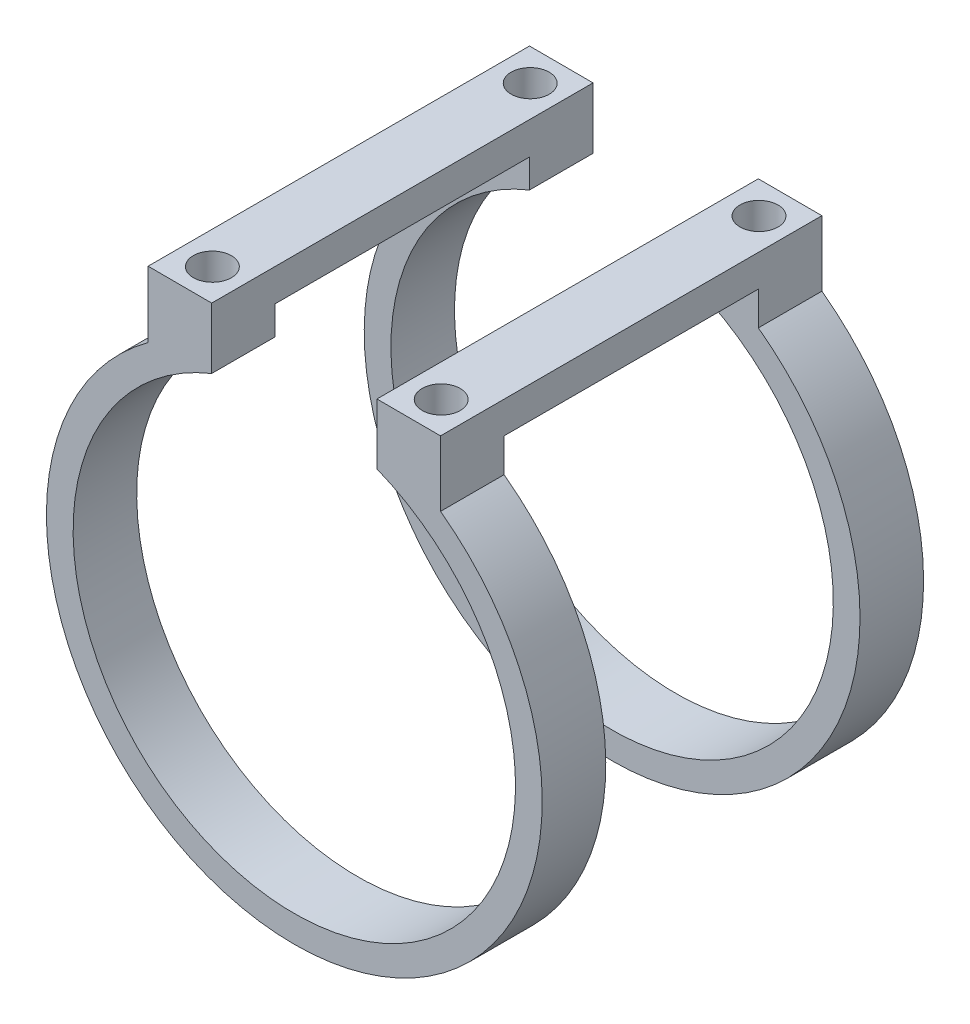
from build123d import *

# Parameters (mm, degrees)
SALIENTE_EXTRUIR1_DEPTH    = 30
CORTAR_EXTRUIR2_DEPTH      = 42.46352267
CORTAR_EXTRUIR2_DEPTH_BACK = 42.46352267
CROQUIS3_W                 = 20
CROQUIS3_H                 = 40.792863267
CORTAR_EXTRUIR3_DEPTH      = 55.00268459
CORTAR_EXTRUIR3_DEPTH_BACK = 10
CROQUIS4_R                 = 1.5


with BuildPart() as part:
    # Croquis1 → Saliente-Extruir1 (new body)
    with BuildSketch(Plane.XY):
        with BuildLine():
            Line((-6.5, 20.93890902), (-6.5, 16.140322178))
            ThreePointArc((-6.5, 16.140322178), (0, -17.4), (6.5, 16.140322178))
            Line((6.5, 16.140322178), (6.5, 20.905653754))
            Line((6.5, 20.905653754), (11.5, 20.892863267))
            Line((11.5, 20.892863267), (11.5, 15.748015748))
            ThreePointArc((11.5, 15.748015748), (0, -19.5), (-11.5, 15.748015748))
            Line((-11.5, 15.748015748), (-11.5, 20.951699507))
            Line((-11.5, 20.951699507), (-6.5, 20.93890902))
        make_face()
    extrude(amount=SALIENTE_EXTRUIR1_DEPTH)

    # Croquis3 → Cortar-Extruir2 (cut, two sides: drawn at the far end of the back side and taken through both)
    with BuildSketch(Plane(origin=(0, 0, 0), x_dir=(0, 0, -1), z_dir=(1, 0, 0)).offset(-CORTAR_EXTRUIR2_DEPTH_BACK)):
        with Locations((-15, -2.003568366)):
            Rectangle(CROQUIS3_W, CROQUIS3_H)
    extrude(amount=CORTAR_EXTRUIR2_DEPTH + CORTAR_EXTRUIR2_DEPTH_BACK, mode=Mode.SUBTRACT)

    # Croquis4 → Cortar-Extruir3 (cut, two sides: drawn at the far end of the back side and taken through both)
    with BuildSketch(Plane(origin=(0.053520884, 20.922144475, 0), x_dir=(0.9999967280848749, -0.0025580890416273647, 0), z_dir=(0.0025580890416273647, 0.9999967280848749, 0)).offset(-CORTAR_EXTRUIR3_DEPTH_BACK)):
        with Locations((9, -2.5)):
            Circle(CROQUIS4_R)
        with Locations((-9, -2.5)):
            Circle(CROQUIS4_R)
        with Locations((-9, -27.5)):
            Circle(CROQUIS4_R)
        with Locations((9, -27.5)):
            Circle(CROQUIS4_R)
    extrude(amount=CORTAR_EXTRUIR3_DEPTH + CORTAR_EXTRUIR3_DEPTH_BACK, mode=Mode.SUBTRACT)


solid = part.part
